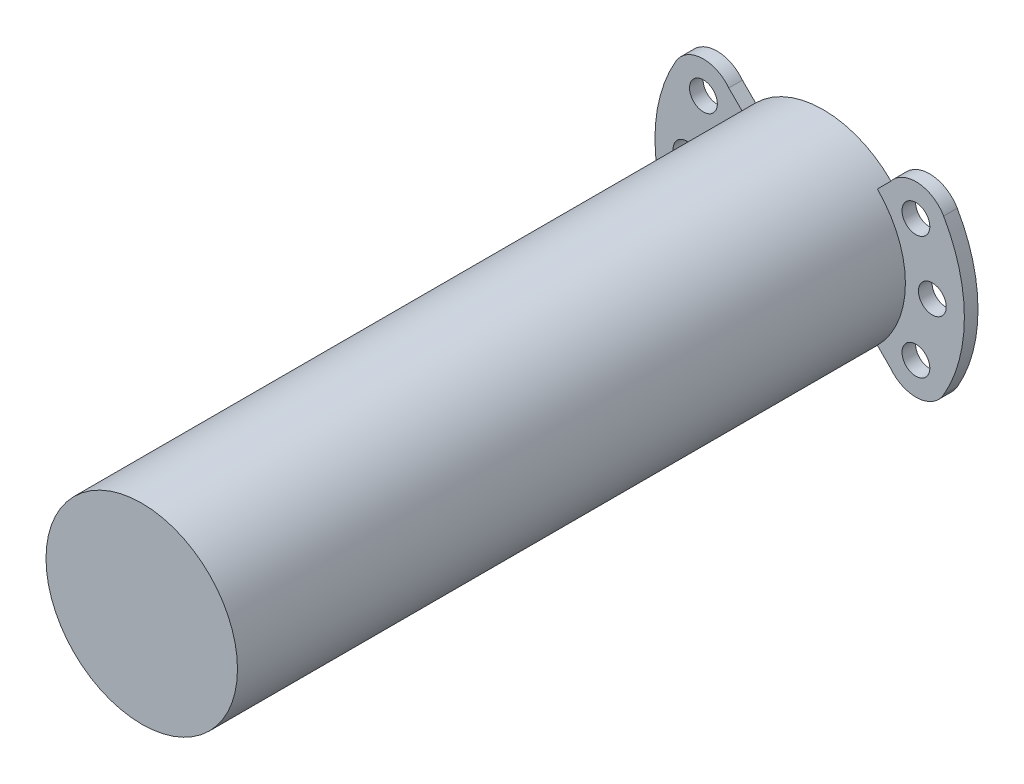
from build123d import *

# Parameters (mm, degrees)
SKETCH1_R            = 21.082
SKETCH1_R_2          = 17.526
BOSS_EXTRUDE1_DEPTH  = 254
BOSS_EXTRUDE2_START  = 6.35
SKETCH2_R            = 21.082
BOSS_EXTRUDE2_DEPTH  = 6.35
SKETCH3_R            = 25.868376463
CUT_EXTRUDE1_DEPTH   = 127
SKETCH4_R            = 34.925
SKETCH4_R_2          = 19.091061219
BOSS_EXTRUDE3_DEPTH  = 3.175
CUT_EXTRUDE2_DEPTH   = 143.203142546
CIRPATTERN1_COUNT    = 12
SKETCH6_R            = 21.082
CUT_EXTRUDE3_DEPTH   = 6.35
SKETCH7_R            = 21.082
BOSS_EXTRUDE4_DEPTH  = 6.35
CUT_EXTRUDE5_DEPTH   = 137.26632471
BOSS_EXTRUDE5_DEPTH  = 3.175
SKETCH13_R           = 20.701
SKETCH13_R_2         = 18.0848
CUT_EXTRUDE6_DEPTH   = 1.016
SKETCH14_R           = 22.3012
SKETCH14_R_2         = 20.701
BOSS_EXTRUDE6_DEPTH  = 3.175
SKETCH15_R           = 3.175
SKETCH15_R_2         = 21.082
BOSS_EXTRUDE7_DEPTH  = 123.825
SKETCH17_R           = 47.464750001
SKETCH17_R_2         = 22.3012
CUT_EXTRUDE7_DEPTH   = 120.65
SKETCH18_R           = 17.526
CUT_EXTRUDE8_DEPTH   = 134.883658048
CUT_EXTRUDE9_START   = -1.016
SKETCH19_R           = 20.701
SKETCH19_R_2         = 18.0848
CUT_EXTRUDE9_DEPTH   = 1.016
SKETCH20_R           = 44.795310745
SKETCH20_R_2         = 22.3012
CUT_EXTRUDE10_DEPTH  = 12.7
BOSS_EXTRUDE8_START  = 31.75
SKETCH22_R           = 22.3012
SKETCH22_R_2         = 20.701
SKETCH22_R_3         = 18.0848
SKETCH22_R_4         = 17.526
BOSS_EXTRUDE8_DEPTH  = 31.75
BOSS_EXTRUDE9_START  = 32.766
SKETCH23_R           = 20.701
SKETCH23_R_2         = 18.0848
BOSS_EXTRUDE9_DEPTH  = 32.766
SKETCH24_R           = 17.526
BOSS_EXTRUDE10_DEPTH = 6.35
SKETCH25_R           = 3.2385
CUT_EXTRUDE11_DEPTH  = 165.308844535


with BuildPart() as part:
    # Sketch1 → Boss-Extrude1 (new body)
    with BuildSketch(Plane.XY):
        Circle(SKETCH1_R)
        Circle(SKETCH1_R_2, mode=Mode.SUBTRACT)
    extrude(amount=BOSS_EXTRUDE1_DEPTH)

    # Sketch2 → Boss-Extrude2 (add)
    with BuildSketch(Plane(origin=(0, 0, 0), x_dir=(-1, 0, 0), z_dir=(0, 0, -1)).offset(BOSS_EXTRUDE2_START)):
        Circle(SKETCH2_R)
    extrude(amount=-BOSS_EXTRUDE2_DEPTH)

    # Sketch3 → Cut-Extrude1 (cut)
    with BuildSketch(Plane.XY.offset(254)):
        Circle(SKETCH3_R)
    extrude(amount=-CUT_EXTRUDE1_DEPTH, mode=Mode.SUBTRACT)

    # Sketch4 → Boss-Extrude3 (add)
    with BuildSketch(Plane.XY.offset(127)):
        Circle(SKETCH4_R)
        Circle(SKETCH4_R_2, mode=Mode.SUBTRACT)
    extrude(amount=-BOSS_EXTRUDE3_DEPTH)

    # Sketch5 → Cut-Extrude2 (cut, through all)
    with BuildSketch(Plane.XY.offset(127)):
        with BuildLine():
            ThreePointArc((0, 31.75), (-3.175, 28.575), (0, 25.4))
            Line((0, 25.4), (0, 31.75))
        make_face()
        with BuildLine():
            Line((0, 31.75), (0, 25.4))
            ThreePointArc((0, 25.4), (2.24506403, 26.32993597), (3.175, 28.575))
            ThreePointArc((3.175, 28.575), (2.24506403, 30.82006403), (0, 31.75))
        make_face()
    cut_extrude2 = extrude(amount=-CUT_EXTRUDE2_DEPTH, mode=Mode.SUBTRACT)

    # CirPattern1: Cut-Extrude2 ×12 about axis
    cirpattern1_axis = Axis((0, 0, 0), (0, 0, 1))
    for i in range(1, CIRPATTERN1_COUNT):
        add(cut_extrude2.rotate(cirpattern1_axis, i * 360 / CIRPATTERN1_COUNT), mode=Mode.SUBTRACT)

    # Sketch6 → Cut-Extrude3 (cut)
    with BuildSketch(Plane(origin=(0, 0, -6.35), x_dir=(-1, 0, 0), z_dir=(0, 0, -1))):
        Circle(SKETCH6_R)
    extrude(amount=-CUT_EXTRUDE3_DEPTH, mode=Mode.SUBTRACT)

    # Sketch7 → Boss-Extrude4 (add)
    with BuildSketch(Plane(origin=(0, 0, 0), x_dir=(-1, 0, 0), z_dir=(0, 0, -1))):
        Circle(SKETCH7_R)
    extrude(amount=-BOSS_EXTRUDE4_DEPTH)

    # Sketch8 → Cut-Extrude5 (cut, through all)
    with BuildSketch(Plane.XY.offset(127)):
        with BuildLine():
            ThreePointArc((18.828599641, 18.828599641), (22.949516837, 21.527350272), (27.854121372, 21.069018667))
            ThreePointArc((27.854121372, 21.069018667), (0, 34.925), (-27.854121372, 21.069018667))
            ThreePointArc((-27.854121372, 21.069018667), (-22.949516837, 21.527350272), (-18.828599641, 18.828599641))
            Line((-18.828599641, 18.828599641), (-14.907225161, 14.907225161))
            ThreePointArc((-14.907225161, 14.907225161), (0, 21.082), (14.907225161, 14.907225161))
            Line((14.907225161, 14.907225161), (18.828599641, 18.828599641))
        make_face()
        with BuildLine():
            ThreePointArc((14.907225161, -14.907225161), (0, -21.082), (-14.907225161, -14.907225161))
            Line((-14.907225161, -14.907225161), (-18.828599641, -18.828599641))
            ThreePointArc((-18.828599641, -18.828599641), (-22.949516837, -21.527350272), (-27.854121372, -21.069018667))
            ThreePointArc((-27.854121372, -21.069018667), (0, -34.925), (27.854121372, -21.069018667))
            ThreePointArc((27.854121372, -21.069018667), (22.949516837, -21.527350272), (18.828599641, -18.828599641))
            Line((18.828599641, -18.828599641), (14.907225161, -14.907225161))
        make_face()
    extrude(amount=-CUT_EXTRUDE5_DEPTH, mode=Mode.SUBTRACT)

    # Sketch11 → Boss-Extrude5 (add)
    with BuildSketch(Plane.XY.offset(127)):
        with BuildLine():
            ThreePointArc((31.206854634, 18.017286001), (29.767943301, 19.804028486), (27.854121372, 21.069018667))
            ThreePointArc((27.854121372, 21.069018667), (34.925, 0), (27.854121372, -21.069018667))
            ThreePointArc((27.854121372, -21.069018667), (29.767943301, -19.804028486), (31.206854634, -18.017286001))
            ThreePointArc((31.206854634, -18.017286001), (36.034571885, 0), (31.206854634, 18.017286001))
        make_face()
        with BuildLine():
            ThreePointArc((-27.854121372, 21.069018667), (-29.767943301, 19.804028486), (-31.206854634, 18.017286001))
            ThreePointArc((-31.206854634, 18.017286001), (-36.034571885, -1.77e-07), (-31.206854456, -18.017286308))
            ThreePointArc((-31.206854456, -18.017286308), (-29.767943169, -19.804028605), (-27.854121372, -21.069018667))
            ThreePointArc((-27.854121372, -21.069018667), (-34.925, 0), (-27.854121372, 21.069018667))
        make_face()
    extrude(amount=-BOSS_EXTRUDE5_DEPTH)

    # Sketch13 → Cut-Extrude6 (cut)
    with BuildSketch(Plane.XY.offset(127)):
        Circle(SKETCH13_R)
        Circle(SKETCH13_R_2, mode=Mode.SUBTRACT)
    extrude(amount=-CUT_EXTRUDE6_DEPTH, mode=Mode.SUBTRACT)

    # Sketch14 → Boss-Extrude6 (add)
    with BuildSketch(Plane.XY.offset(127)):
        Circle(SKETCH14_R)
        Circle(SKETCH14_R_2, mode=Mode.SUBTRACT)
    extrude(amount=-BOSS_EXTRUDE6_DEPTH)

    # Sketch15 → Boss-Extrude7 (add)
    with BuildSketch(Plane(origin=(0, 0, 123.825), x_dir=(-1, 0, 0), z_dir=(0, 0, -1))):
        with BuildLine():
            ThreePointArc((31.206854667, 18.017285943), (25.234555257, 21.731100369), (18.828599641, 18.828599641))
            Line((18.828599641, 18.828599641), (15.769329749, 15.769329749))
            ThreePointArc((15.769329749, 15.769329749), (0, 22.3012), (-15.769329749, 15.769329749))
            Line((-15.769329749, 15.769329749), (-18.828599641, 18.828599641))
            ThreePointArc((-18.828599641, 18.828599641), (-25.234555257, 21.731100369), (-31.206854667, 18.017285943))
            ThreePointArc((-31.206854667, 18.017285943), (-36.034571885, 0), (-31.206854667, -18.017285943))
            ThreePointArc((-31.206854667, -18.017285943), (-25.234555257, -21.731100369), (-18.828599641, -18.828599641))
            Line((-18.828599641, -18.828599641), (-15.769329749, -15.769329749))
            ThreePointArc((-15.769329749, -15.769329749), (0, -22.3012), (15.769329749, -15.769329749))
            Line((15.769329749, -15.769329749), (18.828599641, -18.828599641))
            ThreePointArc((18.828599641, -18.828599641), (25.234555257, -21.731100369), (31.206854667, -18.017285943))
            ThreePointArc((31.206854667, -18.017285943), (36.034571885, 0), (31.206854667, 18.017285943))
        make_face()
        with Locations(Location((28.575, 0, 0), (0, 0, 90))):
            Circle(SKETCH15_R, mode=Mode.SUBTRACT)
        with Locations(Location((-24.746675913, -14.2875, 0), (0, 0, 300))):
            Circle(SKETCH15_R, mode=Mode.SUBTRACT)
        with Locations(Location((-24.746675913, 14.2875, 0), (0, 0, 240))):
            Circle(SKETCH15_R, mode=Mode.SUBTRACT)
        with Locations(Location((-28.575, 0, 0), (0, 0, 270))):
            Circle(SKETCH15_R, mode=Mode.SUBTRACT)
        Circle(SKETCH15_R_2, mode=Mode.SUBTRACT)
        with Locations(Location((24.746675913, -14.2875, 0), (0, 0, 60))):
            Circle(SKETCH15_R, mode=Mode.SUBTRACT)
        with Locations(Location((24.746675913, 14.2875, 0), (0, 0, 120))):
            Circle(SKETCH15_R, mode=Mode.SUBTRACT)
    extrude(amount=BOSS_EXTRUDE7_DEPTH)

    # Sketch17 → Cut-Extrude7 (cut)
    with BuildSketch(Plane.XY.offset(123.825)):
        Circle(SKETCH17_R)
        with Locations(Location((0, 0, 0), (0, 0, 315))):
            Circle(SKETCH17_R_2, mode=Mode.SUBTRACT)
    extrude(amount=-CUT_EXTRUDE7_DEPTH, mode=Mode.SUBTRACT)

    # Sketch18 → Cut-Extrude8 (cut, through all)
    with BuildSketch(Plane.XY.offset(127)):
        Circle(SKETCH18_R)
    extrude(amount=-CUT_EXTRUDE8_DEPTH, mode=Mode.SUBTRACT)

    # Sketch19 → Cut-Extrude9 (cut)
    with BuildSketch(Plane(origin=(0, 0, 0), x_dir=(-1, 0, 0), z_dir=(0, 0, -1)).offset(CUT_EXTRUDE9_START)):
        with Locations(Location((0, 0, 0), (0, 0, 180))):
            Circle(SKETCH19_R)
        with Locations(Location((0, 0, 0), (0, 0, 180))):
            Circle(SKETCH19_R_2, mode=Mode.SUBTRACT)
    extrude(amount=CUT_EXTRUDE9_DEPTH, mode=Mode.SUBTRACT)

    # Sketch20 → Cut-Extrude10 (cut)
    with BuildSketch(Plane.XY.offset(127)):
        Circle(SKETCH20_R)
        Circle(SKETCH20_R_2, mode=Mode.SUBTRACT)
    extrude(amount=-CUT_EXTRUDE10_DEPTH, mode=Mode.SUBTRACT)

    # Sketch22 → Boss-Extrude8 (add)
    # profile 1 of 2: a face of its own
    with BuildSketch(Plane.XY.offset(127).offset(BOSS_EXTRUDE8_START)):
        Circle(SKETCH22_R)
        Circle(SKETCH22_R_2, mode=Mode.SUBTRACT)
    # profile 2 of 2: a face of its own
    with BuildSketch(Plane.XY.offset(127).offset(BOSS_EXTRUDE8_START)):
        Circle(SKETCH22_R_3)
        Circle(SKETCH22_R_4, mode=Mode.SUBTRACT)
    extrude(amount=-BOSS_EXTRUDE8_DEPTH)

    # Sketch23 → Boss-Extrude9 (add)
    with BuildSketch(Plane.XY.offset(125.984).offset(BOSS_EXTRUDE9_START)):
        with Locations(Location((0, 0, 0), (0, 0, 180))):
            Circle(SKETCH23_R)
        with Locations(Location((0, 0, 0), (0, 0, 180))):
            Circle(SKETCH23_R_2, mode=Mode.SUBTRACT)
    extrude(amount=-BOSS_EXTRUDE9_DEPTH)

    # Sketch24 → Boss-Extrude10 (add)
    with BuildSketch(Plane.XY.offset(158.75)):
        Circle(SKETCH24_R)
    extrude(amount=-BOSS_EXTRUDE10_DEPTH)

    # Sketch25 → Cut-Extrude11 (cut, through all)
    with BuildSketch(Plane(origin=(0, 0, 0), x_dir=(-1, 0, 0), z_dir=(0, 0, -1))):
        with Locations((-24.746675913, 14.2875)):
            Circle(SKETCH25_R)
        with Locations((-28.575, 0)):
            Circle(SKETCH25_R)
        with Locations((-24.746675913, -14.2875)):
            Circle(SKETCH25_R)
        with Locations((24.746675913, 14.2875)):
            Circle(SKETCH25_R)
        with Locations((28.575, 0)):
            Circle(SKETCH25_R)
        with Locations((24.746675913, -14.2875)):
            Circle(SKETCH25_R)
    extrude(amount=-CUT_EXTRUDE11_DEPTH, mode=Mode.SUBTRACT)


solid = part.part
